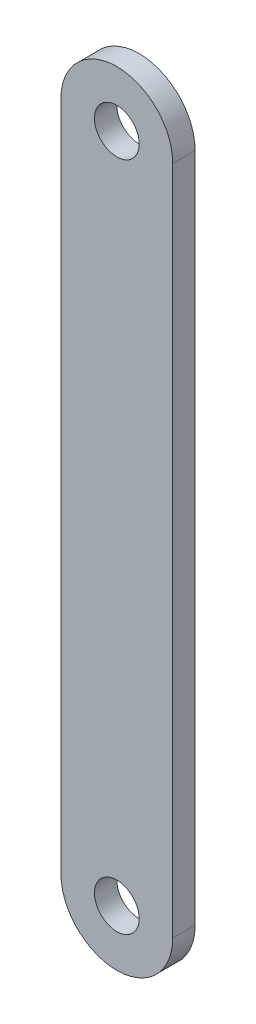
from build123d import *

# Parameters (mm, degrees)
CROQUIS1_R              = 10
SALIENTE_EXTRUIR1_DEPTH = 10


with BuildPart() as part:
    # Croquis1 → Saliente-Extruir1 (new body)
    with BuildSketch(Plane.XY):
        with BuildLine():
            Line((50, 0), (50, 300))
            ThreePointArc((50, 300), (25, 325), (0, 300))
            Line((0, 300), (0, 0))
            ThreePointArc((0, 0), (25, -25), (50, 0))
        make_face()
        with Locations((25, 300)):
            Circle(CROQUIS1_R, mode=Mode.SUBTRACT)
        with Locations((25, 0)):
            Circle(CROQUIS1_R, mode=Mode.SUBTRACT)
    extrude(amount=SALIENTE_EXTRUIR1_DEPTH)


solid = part.part
